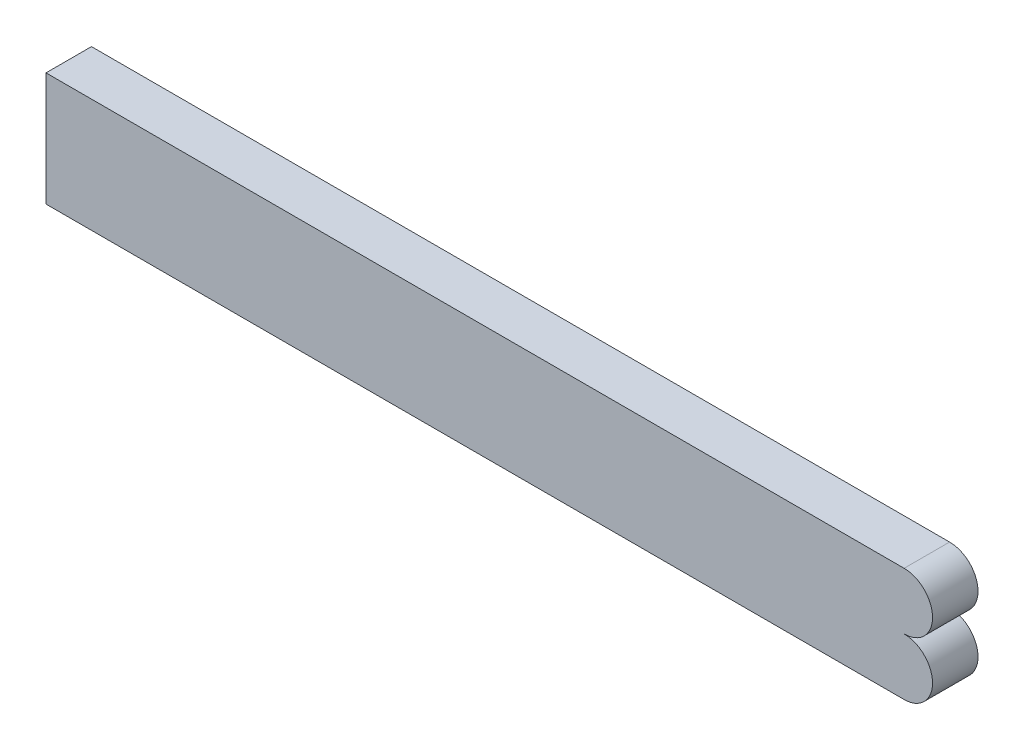
from build123d import *

# Parameters (mm, degrees)
SKETCH_1_W      = 10.679510249
SKETCH_1_H      = 5
SKETCH_1_W_2    = 27.06788567
EXTRUDE_1_DEPTH = 2
EXTRUDE_2_DEPTH = 2


with BuildPart() as part:
    # 草图1 → 凸台-拉伸1 (new body)
    with BuildSketch(Plane.XY):
        with Locations((165.481299773, -71.264027464)):
            Rectangle(SKETCH_1_W, SKETCH_1_H)
        with Locations((146.607601814, -71.264027464)):
            Rectangle(SKETCH_1_W_2, SKETCH_1_H)
    extrude(amount=EXTRUDE_1_DEPTH)

    # 草图2 → 凸台-拉伸2 (add)
    with BuildSketch(Plane.XY.offset(2)):
        with BuildLine():
            ThreePointArc((170.821054898, -68.764027464), (169.571054898, -70.014027464), (170.821054898, -71.264027464))
            Line((170.821054898, -71.264027464), (170.821054898, -68.764027464))
        make_face()
        with BuildLine():
            Line((170.821054898, -68.764027464), (170.821054898, -71.264027464))
            ThreePointArc((170.821054898, -71.264027464), (171.704938375, -70.89791094), (172.071054898, -70.014027464))
            ThreePointArc((172.071054898, -70.014027464), (171.704938375, -69.130143987), (170.821054898, -68.764027464))
        make_face()
        with BuildLine():
            ThreePointArc((172.071054898, -72.514027464), (171.704938375, -71.630143987), (170.821054898, -71.264027464))
            Line((170.821054898, -71.264027464), (170.821054898, -73.764027464))
            ThreePointArc((170.821054898, -73.764027464), (171.704938375, -73.39791094), (172.071054898, -72.514027464))
        make_face()
        with BuildLine():
            Line((170.821054898, -73.764027464), (170.821054898, -71.264027464))
            ThreePointArc((170.821054898, -71.264027464), (169.571054898, -72.514027464), (170.821054898, -73.764027464))
        make_face()
    extrude(amount=-EXTRUDE_2_DEPTH)


solid = part.part
